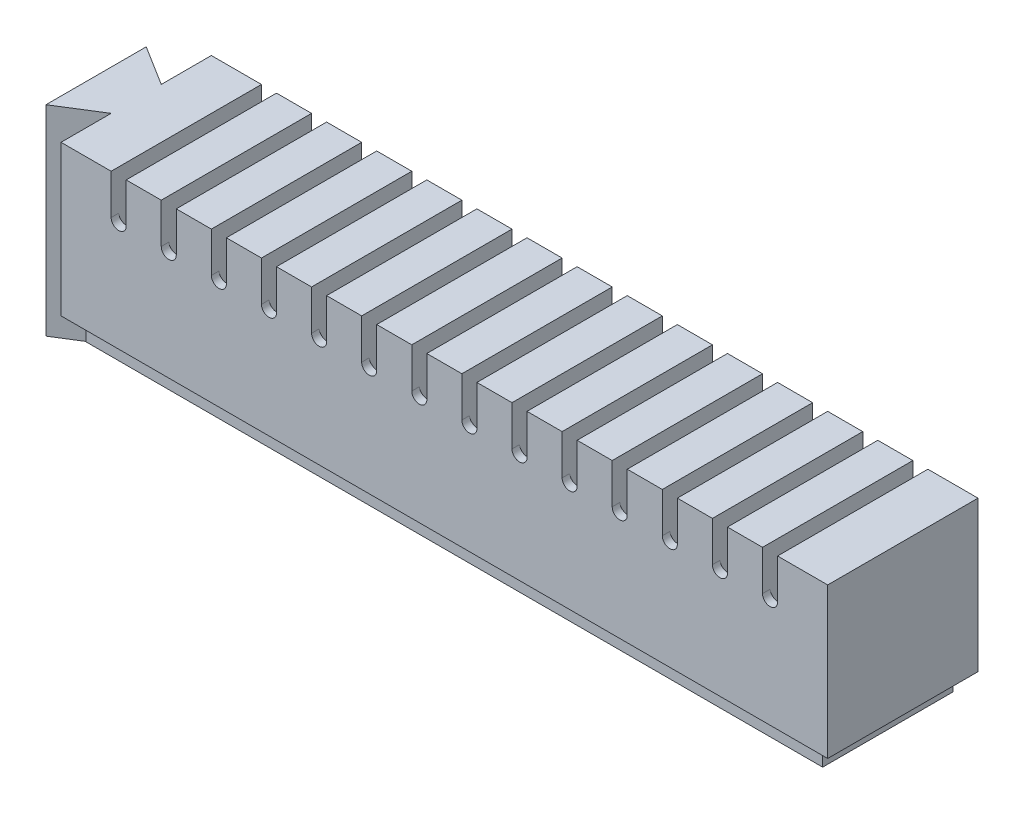
from build123d import *

# Parameters (mm, degrees)
SKETCH1_W            = 3.5
SKETCH1_H            = 15
BOSS_EXTRUDE1_DEPTH  = 15
SKETCH2_W            = 1.5
SKETCH2_H            = 11
CUT_EXTRUDE1_DEPTH   = 13
SKETCH3_W            = 15
SKETCH3_H            = 3
BOSS_EXTRUDE2_DEPTH  = 1.5
LPATTERN1_COUNT      = 15
LPATTERN1_PITCH      = 5
SKETCH4_W            = 15
SKETCH4_H            = 15
BOSS_EXTRUDE3_DEPTH  = 1.5
SKETCH5_W            = 15
SKETCH5_H            = 12
BOSS_EXTRUDE4_DEPTH  = 1.5
SKETCH7_W            = 68.5
SKETCH7_H            = 2
CUT_EXTRUDE2_DEPTH   = 2
SKETCH8_W            = 73.5
SKETCH8_H            = 13
SKETCH8_W_2          = 71.5
SKETCH8_H_2          = 11
BOSS_EXTRUDE5_DEPTH  = 2
SKETCH9_W            = 1.5
SKETCH9_H            = 2.5
BOSS_EXTRUDE6_DEPTH  = 2
LPATTERN2_COUNT      = 14
LPATTERN2_PITCH      = 5
BOSS_EXTRUDE12_DEPTH = 1.5
SKETCH18_R           = 0.75
CUT_EXTRUDE3_DEPTH   = 78.942286341
LPATTERN4_COUNT      = 14
LPATTERN4_PITCH      = 5
BOSS_EXTRUDE13_DEPTH = 20


with BuildPart() as part:
    # Sketch1 → Boss-Extrude1 (new body)
    with BuildSketch(Plane(origin=(0, 0, 0), x_dir=(1, 0, 0), z_dir=(0, 1, 0))):
        with Locations((1.75, 7.5)):
            Rectangle(SKETCH1_W, SKETCH1_H)
    extrude(amount=BOSS_EXTRUDE1_DEPTH)

    # Sketch2 → Cut-Extrude1 (cut)
    with BuildSketch(Plane.XZ):
        with Locations((1.75, -7.5)):
            Rectangle(SKETCH2_W, SKETCH2_H)
    extrude(amount=-CUT_EXTRUDE1_DEPTH, mode=Mode.SUBTRACT)

    # Sketch3 → Boss-Extrude2 (add)
    with BuildSketch(Plane.ZY):
        with Locations((-7.5, 1.5)):
            Rectangle(SKETCH3_W, SKETCH3_H)
    extrude(amount=BOSS_EXTRUDE2_DEPTH)


with BuildPart() as lpattern1_1:
    # LPattern1: pattern copy
    add(part.part.moved(Location(Vector(1, 0, 0) * (1 * LPATTERN1_PITCH))))


with BuildPart() as lpattern1_2:
    # LPattern1: pattern copy
    add(part.part.moved(Location(Vector(1, 0, 0) * (2 * LPATTERN1_PITCH))))


with BuildPart() as lpattern1_3:
    # LPattern1: pattern copy
    add(part.part.moved(Location(Vector(1, 0, 0) * (3 * LPATTERN1_PITCH))))


with BuildPart() as lpattern1_4:
    # LPattern1: pattern copy
    add(part.part.moved(Location(Vector(1, 0, 0) * (4 * LPATTERN1_PITCH))))


with BuildPart() as lpattern1_5:
    # LPattern1: pattern copy
    add(part.part.moved(Location(Vector(1, 0, 0) * (5 * LPATTERN1_PITCH))))


with BuildPart() as lpattern1_6:
    # LPattern1: pattern copy
    add(part.part.moved(Location(Vector(1, 0, 0) * (6 * LPATTERN1_PITCH))))


with BuildPart() as lpattern1_7:
    # LPattern1: pattern copy
    add(part.part.moved(Location(Vector(1, 0, 0) * (7 * LPATTERN1_PITCH))))


with BuildPart() as lpattern1_8:
    # LPattern1: pattern copy
    add(part.part.moved(Location(Vector(1, 0, 0) * (8 * LPATTERN1_PITCH))))


with BuildPart() as lpattern1_9:
    # LPattern1: pattern copy
    add(part.part.moved(Location(Vector(1, 0, 0) * (9 * LPATTERN1_PITCH))))


with BuildPart() as lpattern1_10:
    # LPattern1: pattern copy
    add(part.part.moved(Location(Vector(1, 0, 0) * (10 * LPATTERN1_PITCH))))


with BuildPart() as lpattern1_11:
    # LPattern1: pattern copy
    add(part.part.moved(Location(Vector(1, 0, 0) * (11 * LPATTERN1_PITCH))))


with BuildPart() as lpattern1_12:
    # LPattern1: pattern copy
    add(part.part.moved(Location(Vector(1, 0, 0) * (12 * LPATTERN1_PITCH))))


with BuildPart() as lpattern1_13:
    # LPattern1: pattern copy
    add(part.part.moved(Location(Vector(1, 0, 0) * (13 * LPATTERN1_PITCH))))


with BuildPart() as lpattern1_14:
    # LPattern1: pattern copy
    add(part.part.moved(Location(Vector(1, 0, 0) * (14 * LPATTERN1_PITCH))))


with BuildPart() as lpattern1_1_1:
    add(lpattern1_1.part)

    # Combine1: union LPattern1_2, LPattern1_3, LPattern1_4, LPattern1_5, LPattern1_6, LPattern1_7, LPattern1_8, LPattern1_9, LPattern1_10, LPattern1_11, LPattern1_12, LPattern1_13, LPattern1_14, part
    add(lpattern1_2.part)
    add(lpattern1_3.part)
    add(lpattern1_4.part)
    add(lpattern1_5.part)
    add(lpattern1_6.part)
    add(lpattern1_7.part)
    add(lpattern1_8.part)
    add(lpattern1_9.part)
    add(lpattern1_10.part)
    add(lpattern1_11.part)
    add(lpattern1_12.part)
    add(lpattern1_13.part)
    add(lpattern1_14.part)
    add(part.part)

    # Sketch4 → Boss-Extrude3 (add)
    with BuildSketch(Plane(origin=(73.5, 0, 0), x_dir=(0, 0, -1), z_dir=(1, 0, 0))):
        with Locations((7.5, 7.5)):
            Rectangle(SKETCH4_W, SKETCH4_H)
    extrude(amount=BOSS_EXTRUDE3_DEPTH)

    # Sketch5 → Boss-Extrude4 (add)
    with BuildSketch(Plane.ZY):
        with Locations((-7.5, 9)):
            Rectangle(SKETCH5_W, SKETCH5_H)
    extrude(amount=BOSS_EXTRUDE4_DEPTH)

    # Sketch7 → Cut-Extrude2 (cut)
    with BuildSketch(Plane.XZ):
        with Locations((36.75, -7.5)):
            Rectangle(SKETCH7_W, SKETCH7_H)
    extrude(amount=-CUT_EXTRUDE2_DEPTH, mode=Mode.SUBTRACT)

    # Sketch8 → Boss-Extrude5 (add)
    with BuildSketch(Plane(origin=(0, 0, 0), x_dir=(-1, 0, 0), z_dir=(0, -1, 0))):
        with Locations((-36.75, 7.5)):
            Rectangle(SKETCH8_W, SKETCH8_H)
        with Locations((-36.75, 7.5)):
            Rectangle(SKETCH8_W_2, SKETCH8_H_2, mode=Mode.SUBTRACT)
    extrude(amount=BOSS_EXTRUDE5_DEPTH)

    # Sketch9 → Boss-Extrude6 (add)
    with BuildSketch(Plane.XZ):
        with Locations((4.25, -4.25)):
            Rectangle(SKETCH9_W, SKETCH9_H)
        with Locations((4.25, -10.75)):
            Rectangle(SKETCH9_W, SKETCH9_H)
    boss_extrude6 = extrude(amount=BOSS_EXTRUDE6_DEPTH)

    # LPattern2: Boss-Extrude6 ×14
    with Locations(*[(i * LPATTERN2_PITCH, 0, 0) for i in range(1, LPATTERN2_COUNT)]):
        add(boss_extrude6)

    # Sketch17 → Boss-Extrude12 (add)
    with BuildSketch(Plane.ZY.offset(-70)):
        Polygon((-15, 11), (-14.25, 11), (-13.5, 3), (-15, 3), align=None)
        Polygon((0, 3), (0, 11), (-0.75, 11), (-1.5, 3), align=None)
    boss_extrude12 = extrude(amount=BOSS_EXTRUDE12_DEPTH)

    # Sketch18 → Cut-Extrude3 (cut, through all)
    with BuildSketch(Plane(origin=(0, 0, -15), x_dir=(-1, 0, 0), z_dir=(0, 0, -1))):
        with Locations((-69.25, 11)):
            Circle(SKETCH18_R)
    cut_extrude3 = extrude(amount=-CUT_EXTRUDE3_DEPTH, mode=Mode.SUBTRACT)

    # LPattern4: Boss-Extrude12, Cut-Extrude3 ×14
    with Locations(*[(-i * LPATTERN4_PITCH, 0, 0) for i in range(1, LPATTERN4_COUNT)]):
        add(boss_extrude12)
        add(cut_extrude3, mode=Mode.SUBTRACT)

    # Sketch19 → Boss-Extrude13 (add)
    with BuildSketch(Plane(origin=(0, 15, 0), x_dir=(1, 0, 0), z_dir=(0, 1, 0))):
        Polygon((-1.5, 5), (-5.5, 2.5), (-5.5, 12.5), (-1.5, 10), align=None)
    extrude(amount=-BOSS_EXTRUDE13_DEPTH)


solid = lpattern1_1_1.part
